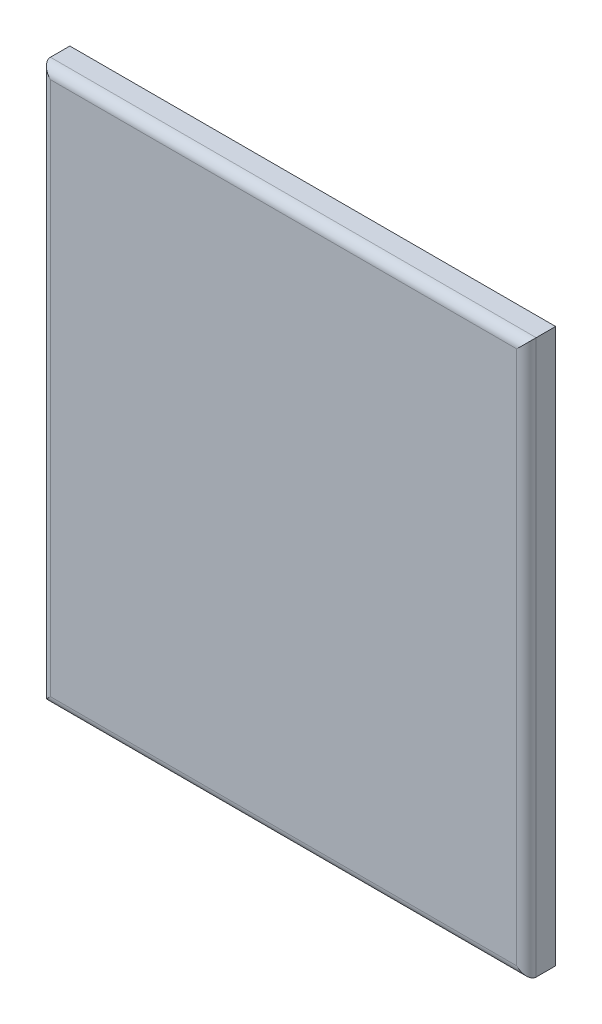
from build123d import *

# Parameters (mm, degrees)
SKETCH1_W           = 500
SKETCH1_H           = 570
BOSS_EXTRUDE1_DEPTH = 30
FILLET1_R           = 10


with BuildPart() as part:
    # Sketch1 → Boss-Extrude1 (new body)
    with BuildSketch(Plane.XY):
        with Locations((-250, -285)):
            Rectangle(SKETCH1_W, SKETCH1_H)
    extrude(amount=BOSS_EXTRUDE1_DEPTH)

    # Fillet1
    fillet1_edges = [part.edges().sort_by_distance(p)[0] for p in [
        (-500, -285, 30),
        (-250, -570, 30),
        (0, -285, 30),
        (-250, 0, 30),
    ]]
    fillet(fillet1_edges, radius=FILLET1_R)


solid = part.part
